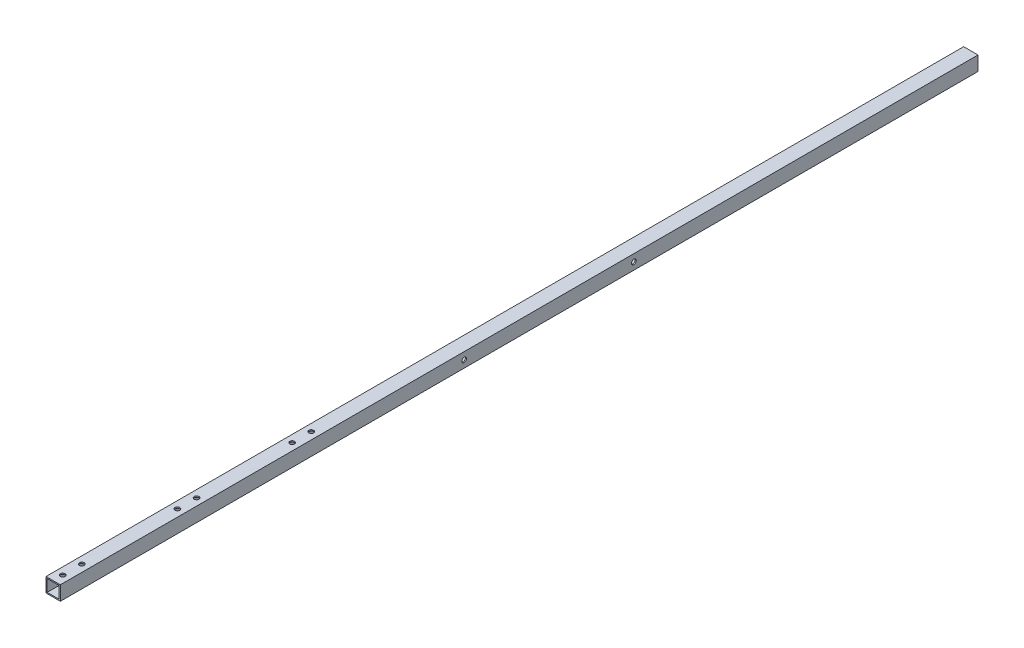
from build123d import *

# Parameters (mm, degrees)
SKETCH1_W               = 19.05
SKETCH1_H               = 19.05
SKETCH1_W_2             = 15.875
SKETCH1_H_2             = 15.875
BOSS_EXTRUDE1_DEPTH     = 609.6
CUT_EXTRUDE1_DEPTH      = 610.748809962
CUT_EXTRUDE1_DEPTH_BACK = 610.748809962
SKETCH2_R               = 3.175
SKETCH3_R               = 3.175
CUT_EXTRUDE2_DEPTH      = 610.971956835


with BuildPart() as part:
    # Sketch1 → Boss-Extrude1 (new, symmetric)
    with BuildSketch(Plane.XY):
        Rectangle(SKETCH1_W, SKETCH1_H)
        Rectangle(SKETCH1_W_2, SKETCH1_H_2, mode=Mode.SUBTRACT)
    extrude(amount=BOSS_EXTRUDE1_DEPTH, both=True)

    # Sketch2 → Cut-Extrude1 (cut, two sides: drawn at the far end of the back side and taken through both)
    with BuildSketch(Plane(origin=(0, 0, 0), x_dir=(1, 0, 0), z_dir=(0, 1, 0)).offset(-CUT_EXTRUDE1_DEPTH_BACK)):
        with Locations(Location((0, -596.9, 0), (0, 0, 270))):
            Circle(SKETCH2_R)
        with Locations(Location((0, -571.5, 0), (0, 0, 270))):
            Circle(SKETCH2_R)
        with Locations(Location((0, -444.5, 0), (0, 0, 270))):
            Circle(SKETCH2_R)
        with Locations(Location((0, -419.1, 0), (0, 0, 270))):
            Circle(SKETCH2_R)
        with Locations(Location((0, -292.1, 0), (0, 0, 270))):
            Circle(SKETCH2_R)
        with Locations(Location((0, -266.7, 0), (0, 0, 270))):
            Circle(SKETCH2_R)
    extrude(amount=CUT_EXTRUDE1_DEPTH + CUT_EXTRUDE1_DEPTH_BACK, mode=Mode.SUBTRACT)

    # Sketch3 → Cut-Extrude2 (cut, through all)
    with BuildSketch(Plane.ZY.offset(9.525)):
        with Locations((-152.4, 0)):
            Circle(SKETCH3_R)
        with Locations((73.03, 0)):
            Circle(SKETCH3_R)
    extrude(amount=-CUT_EXTRUDE2_DEPTH, mode=Mode.SUBTRACT)


solid = part.part
